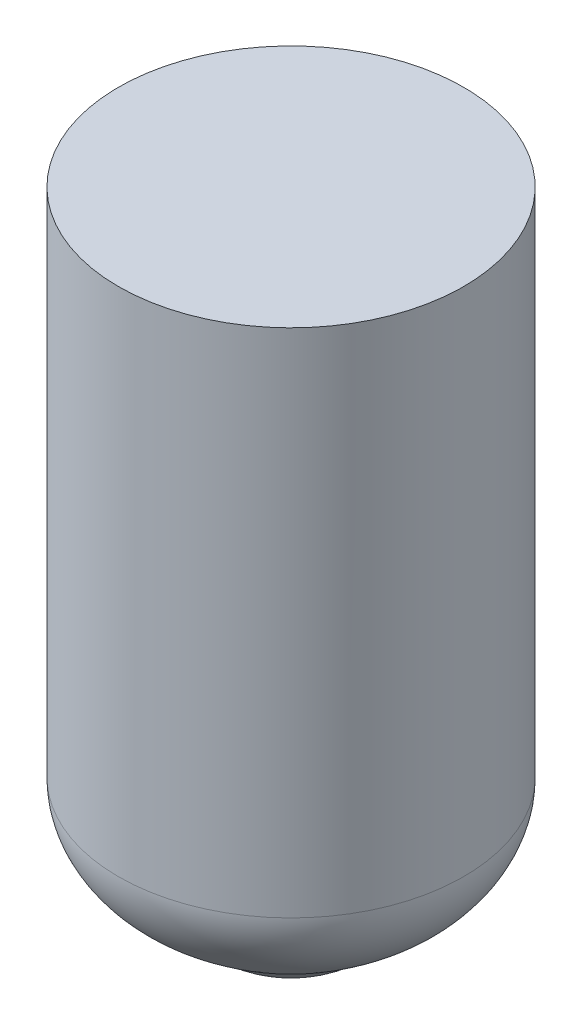
from build123d import *


with BuildPart() as part:
    # Sketch1 → Revolve1 (revolve)
    with BuildSketch(Plane.XY, mode=Mode.PRIVATE) as revolve1_sk:
        with BuildLine():
            Line((-30.4, 25), (-30.4, 115))
            Line((-30.4, 115), (0, 115))
            Line((0, 115), (0, 0))
            add(Edge.make_bspline(
                [(0, 0), (-10.531477599, 0), (-12.538391125, 4.760646346), (-26.102767351, 12.414652189), (-30.4, 20.520250324), (-30.4, 25)],
                knots=[0, 0, 0, 0, 0.388265392, 0.683335771, 1, 1, 1, 1], degree=3))
        make_face()
    revolve(revolve1_sk.sketch.rotate(Axis((0, 115, 0), (0, -1, 0)), 270), axis=Axis((0, 115, 0), (0, -1, 0)))


solid = part.part
